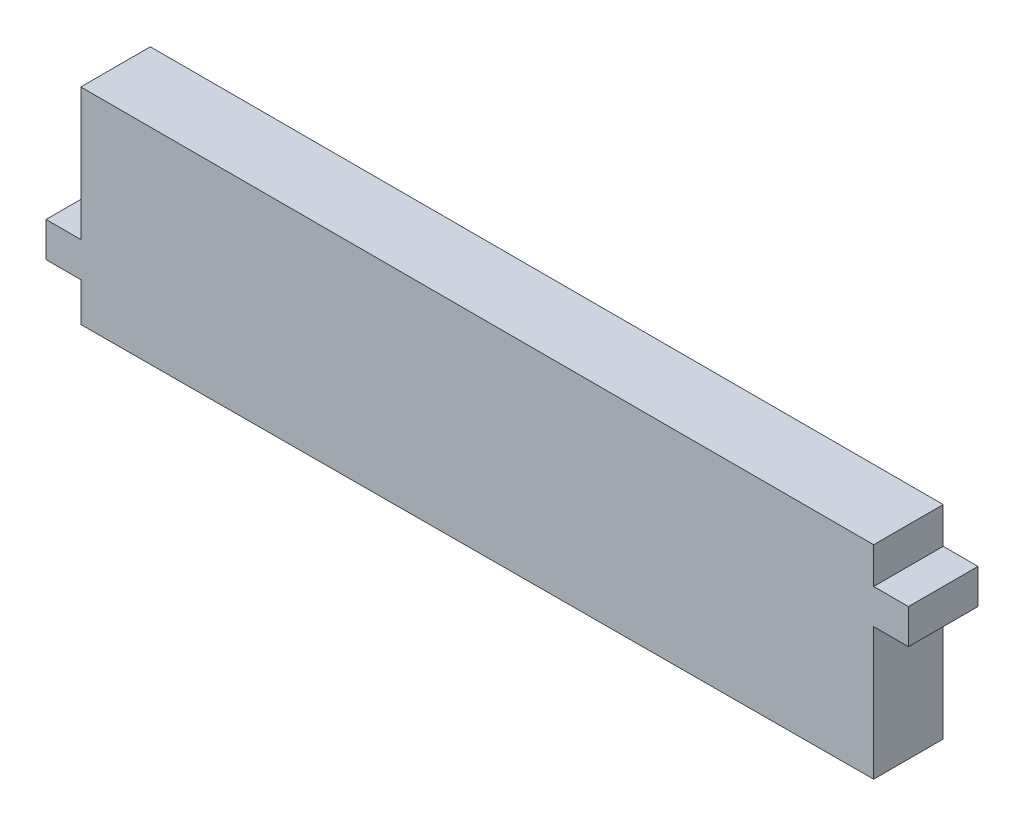
from build123d import *

# Parameters (mm, degrees)
BOSS_EXTRUDE1_DEPTH = 6.35


with BuildPart() as part:
    # Sketch1 → Boss-Extrude1 (new body)
    with BuildSketch(Plane.XY):
        Polygon((15.805910266, -23.248267498), (12.630910266, -23.248267498), (12.630910266, -26.423267498), (15.805910266, -26.423267498), (15.805910266, -29.967301746), (88.195910266, -29.725267498), (88.195910266, -23.248267498), (88.195910266, -17.660267498), (91.370910266, -17.660267498), (91.370910266, -14.485267498), (88.195910266, -14.485267498), (88.195910266, -11.183267498), (15.805910266, -11.183267498), align=None)
    extrude(amount=BOSS_EXTRUDE1_DEPTH)


solid = part.part
